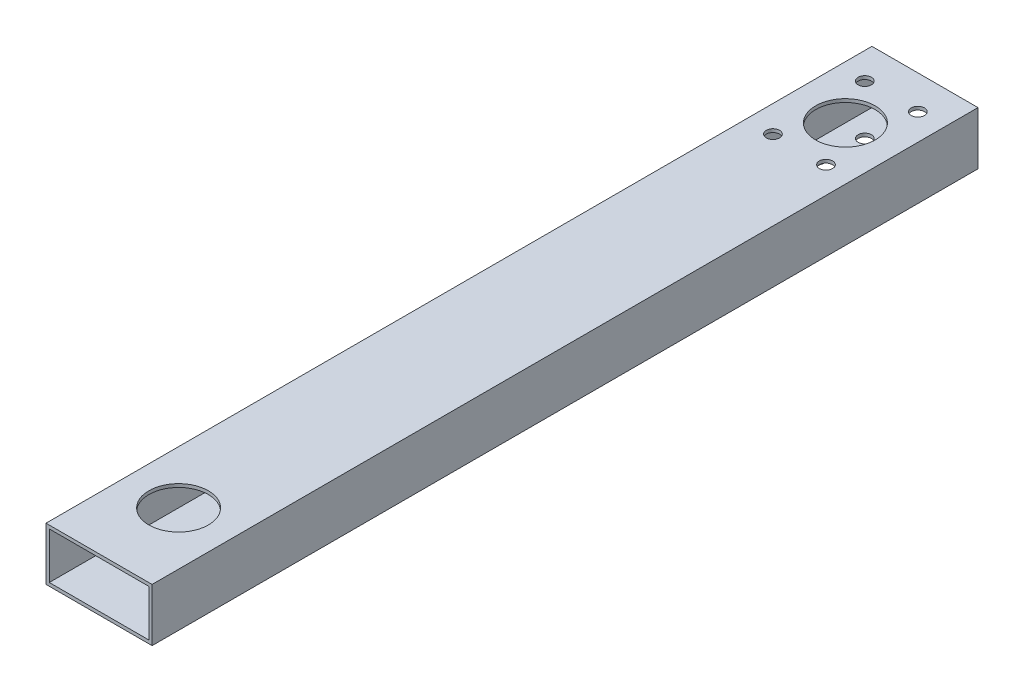
from build123d import *

# Parameters (mm, degrees)
SKETCH1_W               = 50.8
SKETCH1_H               = 25.4
SKETCH1_W_2             = 47.625
SKETCH1_H_2             = 22.225
BOSS_EXTRUDE1_DEPTH     = 395.478
CUT_EXTRUDE1_DEPTH      = 400.535540952
CUT_EXTRUDE1_DEPTH_BACK = 400.535540952
SKETCH2_R               = 14.224
SKETCH2_R_2             = 3.175


with BuildPart() as part:
    # Sketch1 → Boss-Extrude1 (new body)
    with BuildSketch(Plane.XY):
        with Locations((25.4, 12.7)):
            Rectangle(SKETCH1_W, SKETCH1_H)
        with Locations((25.4, 12.7)):
            Rectangle(SKETCH1_W_2, SKETCH1_H_2, mode=Mode.SUBTRACT)
    extrude(amount=BOSS_EXTRUDE1_DEPTH)

    # Sketch2 → Cut-Extrude1 (cut, two sides: drawn at the far end of the back side and taken through both)
    with BuildSketch(Plane(origin=(0, 25.4, 0), x_dir=(1, 0, 0), z_dir=(0, 1, 0)).offset(-CUT_EXTRUDE1_DEPTH_BACK)):
        with Locations(Location((25.4, -38.1, 0), (0, 0, 90))):
            Circle(SKETCH2_R)
        with Locations(Location((12.7, -16.102954744, 0), (0, 0, 90))):
            Circle(SKETCH2_R_2)
        with Locations(Location((12.7, -60.097045256, 0), (0, 0, 90))):
            Circle(SKETCH2_R_2)
        with Locations(Location((38.1, -60.097045256, 0), (0, 0, 90))):
            Circle(SKETCH2_R_2)
        with Locations(Location((38.1, -16.102954744, 0), (0, 0, 90))):
            Circle(SKETCH2_R_2)
        with Locations(Location((25.4, -357.378, 0), (0, 0, 90))):
            Circle(SKETCH2_R)
    extrude(amount=CUT_EXTRUDE1_DEPTH + CUT_EXTRUDE1_DEPTH_BACK, mode=Mode.SUBTRACT)


solid = part.part
